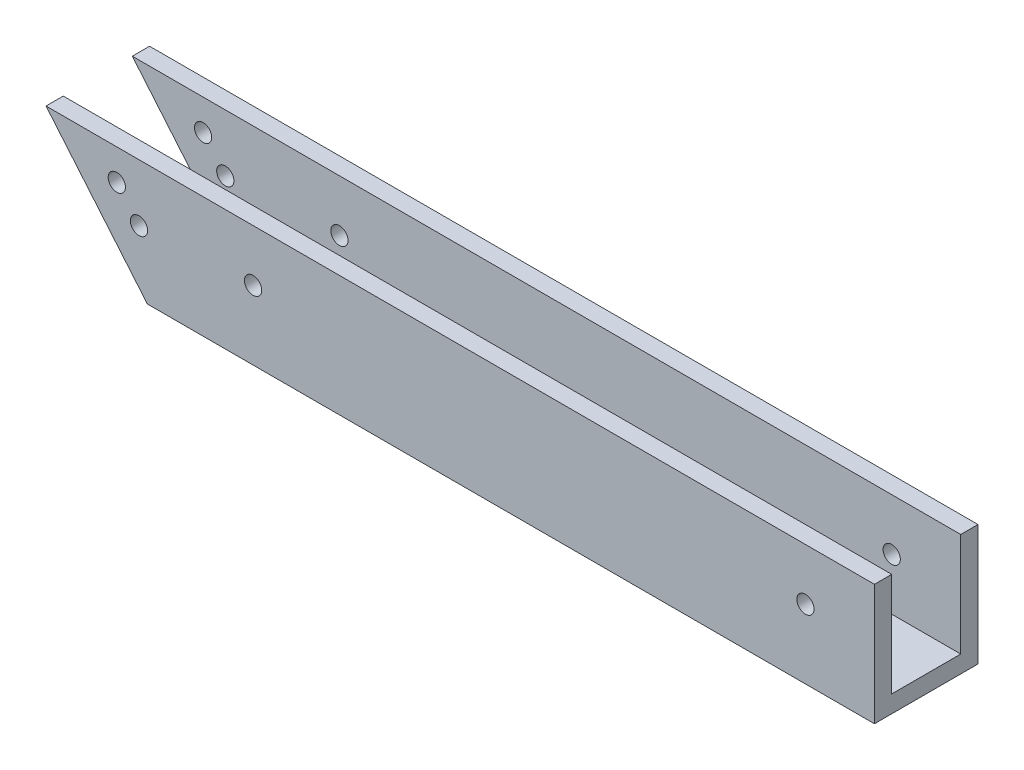
from build123d import *

# Parameters (mm, degrees)
SKETCH1_W                                            = 304.8
SKETCH1_H                                            = 38.1
BOSS_EXTRUDE1_DEPTH                                  = 44.45
SKETCH2_W                                            = 304.8
SKETCH2_H                                            = 25.4
CUT_EXTRUDE1_DEPTH                                   = 38.1
CUT_EXTRUDE3_DEPTH                                   = 38.1
SKETCH5_R                                            = 3.175
CUT_EXTRUDE4_DEPTH                                   = 6.35
CSK_SLOT_FOR_1_4_FLAT_HEAD_MACHINE_SCREW_D           = 6.7564
CSK_SLOT_FOR_1_4_FLAT_HEAD_MACHINE_SCREW_CSINK_D     = 12.8778
CSK_SLOT_FOR_1_4_FLAT_HEAD_MACHINE_SCREW_CSINK_ANGLE = 100
SKETCH12_R                                           = 3.175
CUT_EXTRUDE5_DEPTH                                   = 6.35


with BuildPart() as part:
    # Sketch1 → Boss-Extrude1 (new body)
    with BuildSketch(Plane(origin=(0, 0, 0), x_dir=(1, 0, 0), z_dir=(0, 1, 0))):
        Rectangle(SKETCH1_W, SKETCH1_H)
    extrude(amount=BOSS_EXTRUDE1_DEPTH)

    # Sketch2 → Cut-Extrude1 (cut)
    with BuildSketch(Plane(origin=(0, 44.45, 0), x_dir=(1, 0, 0), z_dir=(0, 1, 0))):
        Rectangle(SKETCH2_W, SKETCH2_H)
    extrude(amount=-CUT_EXTRUDE1_DEPTH, mode=Mode.SUBTRACT)

    # Sketch4 → Cut-Extrude3 (cut)
    with BuildSketch(Plane.XY.offset(19.05)):
        Polygon((-152.4, 44.45), (-115.102021394, 0), (-152.4, 0), align=None)
    extrude(amount=-CUT_EXTRUDE3_DEPTH, mode=Mode.SUBTRACT)

    # Sketch5 → Cut-Extrude4 (cut)
    with BuildSketch(Plane.XY.offset(19.05)):
        with Locations((-126.344430286, 33.155873788)):
            Circle(SKETCH5_R)
        with Locations((-118.181027643, 23.42710936)):
            Circle(SKETCH5_R)
    cut_extrude4 = extrude(amount=-CUT_EXTRUDE4_DEPTH, mode=Mode.SUBTRACT)

    # Mirror1: Cut-Extrude4 across plane
    add(cut_extrude4.mirror(Plane.XY), mode=Mode.SUBTRACT)

    # CSK SLOT for 1/4 Flat Head Machine Screw (100)1 (through all)
    with Locations(Plane(origin=(0, 6.35, 0), x_dir=(1, 0, 0), z_dir=(0, 1, 0))):
        with Locations((-12.7, 0), (12.7, 0), (38.1, 0)):
            CounterSinkHole(CSK_SLOT_FOR_1_4_FLAT_HEAD_MACHINE_SCREW_D / 2, CSK_SLOT_FOR_1_4_FLAT_HEAD_MACHINE_SCREW_CSINK_D / 2, counter_sink_angle=CSK_SLOT_FOR_1_4_FLAT_HEAD_MACHINE_SCREW_CSINK_ANGLE)

    # Sketch12 → Cut-Extrude5 (cut)
    with BuildSketch(Plane.XY.offset(19.05)):
        with Locations((-76.2, 25.4)):
            Circle(SKETCH12_R)
        with Locations((127, 25.4)):
            Circle(SKETCH12_R)
    cut_extrude5 = extrude(amount=-CUT_EXTRUDE5_DEPTH, mode=Mode.SUBTRACT)

    # Mirror2: Cut-Extrude5 across plane
    add(cut_extrude5.mirror(Plane.XY), mode=Mode.SUBTRACT)


solid = part.part
